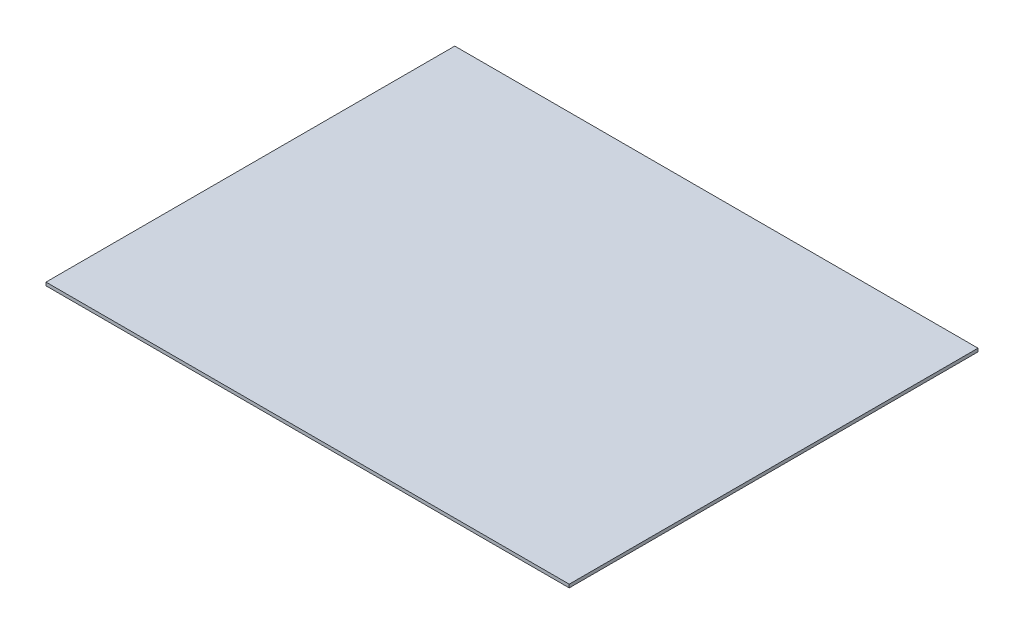
from build123d import *

# Parameters (mm, degrees)
SKETCH1_W           = 160
SKETCH1_H           = 125
BOSS_EXTRUDE1_DEPTH = 1


with BuildPart() as part:
    # Sketch1 → Boss-Extrude1 (new body)
    with BuildSketch(Plane(origin=(0, 0, 0), x_dir=(1, 0, 0), z_dir=(0, 1, 0))):
        Rectangle(SKETCH1_W, SKETCH1_H)
    extrude(amount=BOSS_EXTRUDE1_DEPTH)


solid = part.part
